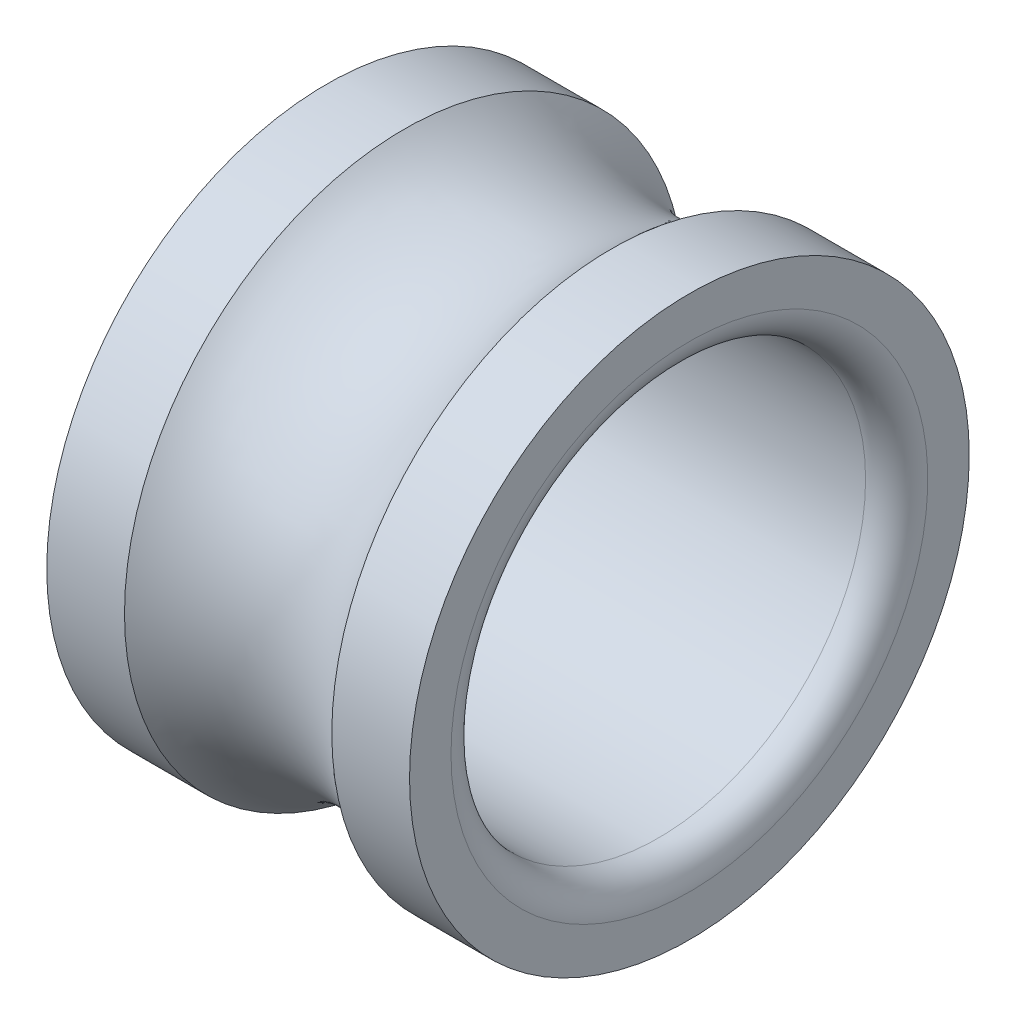
from build123d import *


with BuildPart() as part:
    # Çizim1 → Döndür1 (revolve)
    with BuildSketch(Plane.XY, mode=Mode.PRIVATE) as d_nd_r1_sk:
        with BuildLine():
            Line((3.5, 5.4), (3.5, 4.6))
            ThreePointArc((3.5, 4.6), (3.324264069, 4.175735931), (2.9, 4))
            Line((2.9, 4), (-2.9, 4))
            ThreePointArc((-2.9, 4), (-3.324264069, 4.175735931), (-3.5, 4.6))
            Line((-3.5, 4.6), (-3.5, 5.4))
            Line((-3.5, 5.4), (-2, 5.4))
            ThreePointArc((-2, 5.4), (0, 4.636067977), (2, 5.4))
            Line((2, 5.4), (3.5, 5.4))
        make_face()
    revolve(d_nd_r1_sk.sketch.rotate(Axis((-20.148687567, 0, 0), (1, 0, 0)), 90), axis=Axis((-20.148687567, 0, 0), (1, 0, 0)))


solid = part.part
